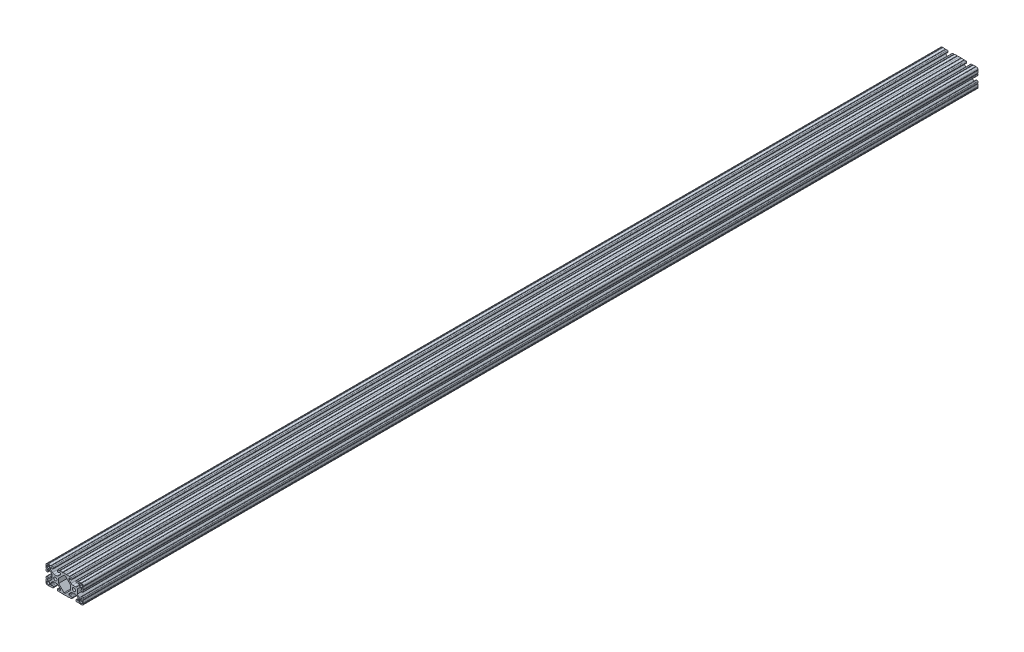
from build123d import *

# Parameters (mm, degrees)
SKETCH3_R      = 3.3274
EXTRUDE1_DEPTH = 914.4


with BuildPart() as part:
    # Sketch3 → Extrude1 (new, symmetric)
    with BuildSketch(Plane.XY):
        with BuildLine():
            Line((15.764194098, 19.048065876), (19.05, 19.16278985))
            Line((19.05, 19.16278985), (22.335805902, 19.048065876))
            Line((22.335805902, 19.048065876), (22.405105476, 19.045645881))
            ThreePointArc((22.405105476, 19.045645881), (22.993059391, 18.4151425), (23.623562772, 19.003096415))
            Line((23.623562772, 19.003096415), (28.755105476, 18.823898995))
            ThreePointArc((28.755105476, 18.823898995), (29.343059391, 18.193395614), (29.973562772, 18.781349529))
            Line((29.973562772, 18.781349529), (32.517119053, 18.692526586))
            ThreePointArc((32.517119053, 18.692526586), (33.613895135, 18.192696929), (34.036, 17.063726184))
            Line((34.036, 17.063726184), (34.007633689, 16.25142132))
            ThreePointArc((34.007633689, 16.25142132), (33.507804032, 15.154645238), (32.378833287, 14.732540373))
            Line((32.378833287, 14.732540373), (31.2293, 14.732540373))
            Line((31.2293, 14.732540373), (31.2293, 15.644526586))
            Line((31.2293, 15.644526586), (29.083, 15.644526586))
            ThreePointArc((29.083, 15.644526586), (28.184974388, 15.272552198), (27.813, 14.374526586))
            Line((27.813, 14.374526586), (27.813, 12.968312693))
            ThreePointArc((27.813, 12.968312693), (27.909672994, 12.482304734), (28.184974388, 12.070287081))
            Line((28.184974388, 12.070287081), (32.107677258, 8.147584211))
            ThreePointArc((32.107677258, 8.147584211), (33.648623281, 7.117956996), (35.466293048, 6.7564))
            Line((35.466293048, 6.7564), (40.733706952, 6.7564))
            ThreePointArc((40.733706952, 6.7564), (42.551376719, 7.117956996), (44.092322742, 8.147584211))
            Line((44.092322742, 8.147584211), (48.015025612, 12.070287081))
            ThreePointArc((48.015025612, 12.070287081), (48.290327006, 12.482304734), (48.387, 12.968312693))
            Line((48.387, 12.968312693), (48.387, 14.374526586))
            ThreePointArc((48.387, 14.374526586), (48.015025612, 15.272552198), (47.117, 15.644526586))
            Line((47.117, 15.644526586), (44.9707, 15.644526586))
            Line((44.9707, 15.644526586), (44.9707, 14.732540373))
            Line((44.9707, 14.732540373), (43.821166713, 14.732540373))
            ThreePointArc((43.821166713, 14.732540373), (42.692195968, 15.154645238), (42.192366311, 16.25142132))
            Line((42.192366311, 16.25142132), (42.164, 17.063726184))
            ThreePointArc((42.164, 17.063726184), (42.586104865, 18.192696929), (43.682880947, 18.692526586))
            Line((43.682880947, 18.692526586), (46.226437228, 18.781349529))
            ThreePointArc((46.226437228, 18.781349529), (46.856940609, 18.193395614), (47.444894524, 18.823898995))
            Line((47.444894524, 18.823898995), (52.576437228, 19.003096415))
            ThreePointArc((52.576437228, 19.003096415), (53.206940609, 18.4151425), (53.794894524, 19.045645881))
            Line((53.794894524, 19.045645881), (53.864194098, 19.048065876))
            ThreePointArc((53.864194098, 19.048065876), (56.22006403, 18.12006403), (57.148065876, 15.764194098))
            Line((57.148065876, 15.764194098), (57.145645881, 15.694894524))
            ThreePointArc((57.145645881, 15.694894524), (56.5151425, 15.106940609), (57.103096415, 14.476437228))
            Line((57.103096415, 14.476437228), (56.923898995, 9.344894524))
            ThreePointArc((56.923898995, 9.344894524), (56.293395614, 8.756940609), (56.881349529, 8.126437228))
            Line((56.881349529, 8.126437228), (56.792526586, 5.582880947))
            ThreePointArc((56.792526586, 5.582880947), (56.292696929, 4.486104865), (55.163726184, 4.064))
            Line((55.163726184, 4.064), (54.35142132, 4.092366311))
            ThreePointArc((54.35142132, 4.092366311), (53.254645238, 4.592195968), (52.832540373, 5.721166713))
            Line((52.832540373, 5.721166713), (52.832540373, 6.8707))
            Line((52.832540373, 6.8707), (53.744526586, 6.8707))
            Line((53.744526586, 6.8707), (53.744526586, 9.017))
            ThreePointArc((53.744526586, 9.017), (53.372552198, 9.915025612), (52.474526586, 10.287))
            Line((52.474526586, 10.287), (50.542261469, 10.287))
            Line((50.542261469, 10.287), (44.8564, 4.601138531))
            Line((44.8564, 4.601138531), (44.8564, -4.601138531))
            Line((44.8564, -4.601138531), (50.542261469, -10.287))
            Line((50.542261469, -10.287), (52.474526586, -10.287))
            ThreePointArc((52.474526586, -10.287), (53.372552198, -9.915025612), (53.744526586, -9.017))
            Line((53.744526586, -9.017), (53.744526586, -6.8707))
            Line((53.744526586, -6.8707), (52.832540373, -6.8707))
            Line((52.832540373, -6.8707), (52.832540373, -5.721166713))
            ThreePointArc((52.832540373, -5.721166713), (53.254645238, -4.592195968), (54.35142132, -4.092366311))
            Line((54.35142132, -4.092366311), (55.163726184, -4.064))
            ThreePointArc((55.163726184, -4.064), (56.292696929, -4.486104865), (56.792526586, -5.582880947))
            Line((56.792526586, -5.582880947), (56.881349529, -8.126437228))
            ThreePointArc((56.881349529, -8.126437228), (56.293395614, -8.756940609), (56.923898995, -9.344894524))
            Line((56.923898995, -9.344894524), (57.103096415, -14.476437228))
            ThreePointArc((57.103096415, -14.476437228), (56.5151425, -15.106940609), (57.145645881, -15.694894524))
            Line((57.145645881, -15.694894524), (57.148065876, -15.764194098))
            ThreePointArc((57.148065876, -15.764194098), (56.22006403, -18.12006403), (53.864194098, -19.048065876))
            Line((53.864194098, -19.048065876), (53.794894524, -19.045645881))
            ThreePointArc((53.794894524, -19.045645881), (53.206940609, -18.4151425), (52.576437228, -19.003096415))
            Line((52.576437228, -19.003096415), (47.444894524, -18.823898995))
            ThreePointArc((47.444894524, -18.823898995), (46.856940609, -18.193395614), (46.226437228, -18.781349529))
            Line((46.226437228, -18.781349529), (43.682880947, -18.692526586))
            ThreePointArc((43.682880947, -18.692526586), (42.586104865, -18.192696929), (42.164, -17.063726184))
            Line((42.164, -17.063726184), (42.192366311, -16.25142132))
            ThreePointArc((42.192366311, -16.25142132), (42.692195968, -15.154645238), (43.821166713, -14.732540373))
            Line((43.821166713, -14.732540373), (44.9707, -14.732540373))
            Line((44.9707, -14.732540373), (44.9707, -15.644526586))
            Line((44.9707, -15.644526586), (47.117, -15.644526586))
            ThreePointArc((47.117, -15.644526586), (48.015025612, -15.272552198), (48.387, -14.374526586))
            Line((48.387, -14.374526586), (48.387, -12.968312693))
            ThreePointArc((48.387, -12.968312693), (48.290327006, -12.482304734), (48.015025612, -12.070287081))
            Line((48.015025612, -12.070287081), (44.092322742, -8.147584211))
            ThreePointArc((44.092322742, -8.147584211), (42.551376719, -7.117956996), (40.733706952, -6.7564))
            Line((40.733706952, -6.7564), (35.466293048, -6.7564))
            ThreePointArc((35.466293048, -6.7564), (33.648623281, -7.117956996), (32.107677258, -8.147584211))
            Line((32.107677258, -8.147584211), (28.184974388, -12.070287081))
            ThreePointArc((28.184974388, -12.070287081), (27.909672994, -12.482304734), (27.813, -12.968312693))
            Line((27.813, -12.968312693), (27.813, -14.374526586))
            ThreePointArc((27.813, -14.374526586), (28.184974388, -15.272552198), (29.083, -15.644526586))
            Line((29.083, -15.644526586), (31.2293, -15.644526586))
            Line((31.2293, -15.644526586), (31.2293, -14.732540373))
            Line((31.2293, -14.732540373), (32.378833287, -14.732540373))
            ThreePointArc((32.378833287, -14.732540373), (33.507804032, -15.154645238), (34.007633689, -16.25142132))
            Line((34.007633689, -16.25142132), (34.036, -17.063726184))
            ThreePointArc((34.036, -17.063726184), (33.613895135, -18.192696929), (32.517119053, -18.692526586))
            Line((32.517119053, -18.692526586), (29.973562772, -18.781349529))
            ThreePointArc((29.973562772, -18.781349529), (29.343059391, -18.193395614), (28.755105476, -18.823898995))
            Line((28.755105476, -18.823898995), (23.623562772, -19.003096415))
            ThreePointArc((23.623562772, -19.003096415), (22.993059391, -18.4151425), (22.405105476, -19.045645881))
            Line((22.405105476, -19.045645881), (22.335805902, -19.048065876))
            Line((22.335805902, -19.048065876), (19.05, -19.16278985))
            Line((19.05, -19.16278985), (15.764194098, -19.048065876))
            Line((15.764194098, -19.048065876), (15.694894524, -19.045645881))
            ThreePointArc((15.694894524, -19.045645881), (15.106940609, -18.4151425), (14.476437228, -19.003096415))
            Line((14.476437228, -19.003096415), (9.344894524, -18.823898995))
            ThreePointArc((9.344894524, -18.823898995), (8.756940609, -18.193395614), (8.126437228, -18.781349529))
            Line((8.126437228, -18.781349529), (5.582880947, -18.692526586))
            ThreePointArc((5.582880947, -18.692526586), (4.486104865, -18.192696929), (4.064, -17.063726184))
            Line((4.064, -17.063726184), (4.092366311, -16.25142132))
            ThreePointArc((4.092366311, -16.25142132), (4.592195968, -15.154645238), (5.721166713, -14.732540373))
            Line((5.721166713, -14.732540373), (6.8707, -14.732540373))
            Line((6.8707, -14.732540373), (6.8707, -15.644526586))
            Line((6.8707, -15.644526586), (9.017, -15.644526586))
            ThreePointArc((9.017, -15.644526586), (9.915025612, -15.272552198), (10.287, -14.374526586))
            Line((10.287, -14.374526586), (10.287, -12.968312693))
            ThreePointArc((10.287, -12.968312693), (10.190327006, -12.482304734), (9.915025612, -12.070287081))
            Line((9.915025612, -12.070287081), (5.992322742, -8.147584211))
            ThreePointArc((5.992322742, -8.147584211), (4.451376719, -7.117956996), (2.633706952, -6.7564))
            Line((2.633706952, -6.7564), (-2.633706952, -6.7564))
            ThreePointArc((-2.633706952, -6.7564), (-4.451376719, -7.117956996), (-5.992322742, -8.147584211))
            Line((-5.992322742, -8.147584211), (-9.915025612, -12.070287081))
            ThreePointArc((-9.915025612, -12.070287081), (-10.190327006, -12.482304734), (-10.287, -12.968312693))
            Line((-10.287, -12.968312693), (-10.287, -14.374526586))
            ThreePointArc((-10.287, -14.374526586), (-9.915025612, -15.272552198), (-9.017, -15.644526586))
            Line((-9.017, -15.644526586), (-6.8707, -15.644526586))
            Line((-6.8707, -15.644526586), (-6.8707, -14.732540373))
            Line((-6.8707, -14.732540373), (-5.721166713, -14.732540373))
            ThreePointArc((-5.721166713, -14.732540373), (-4.592195968, -15.154645238), (-4.092366311, -16.25142132))
            Line((-4.092366311, -16.25142132), (-4.064, -17.063726184))
            ThreePointArc((-4.064, -17.063726184), (-4.486104865, -18.192696929), (-5.582880947, -18.692526586))
            Line((-5.582880947, -18.692526586), (-8.126437228, -18.781349529))
            ThreePointArc((-8.126437228, -18.781349529), (-8.756940609, -18.193395614), (-9.344894524, -18.823898995))
            Line((-9.344894524, -18.823898995), (-14.476437228, -19.003096415))
            ThreePointArc((-14.476437228, -19.003096415), (-15.106940609, -18.4151425), (-15.694894524, -19.045645881))
            Line((-15.694894524, -19.045645881), (-15.764194098, -19.048065876))
            ThreePointArc((-15.764194098, -19.048065876), (-18.12006403, -18.12006403), (-19.048065876, -15.764194098))
            Line((-19.048065876, -15.764194098), (-19.045645881, -15.694894524))
            ThreePointArc((-19.045645881, -15.694894524), (-18.4151425, -15.106940609), (-19.003096415, -14.476437228))
            Line((-19.003096415, -14.476437228), (-18.823898995, -9.344894524))
            ThreePointArc((-18.823898995, -9.344894524), (-18.193395614, -8.756940609), (-18.781349529, -8.126437228))
            Line((-18.781349529, -8.126437228), (-18.692526586, -5.582880947))
            ThreePointArc((-18.692526586, -5.582880947), (-18.192696929, -4.486104865), (-17.063726184, -4.064))
            Line((-17.063726184, -4.064), (-16.25142132, -4.092366311))
            ThreePointArc((-16.25142132, -4.092366311), (-15.154645238, -4.592195968), (-14.732540373, -5.721166713))
            Line((-14.732540373, -5.721166713), (-14.732540373, -6.8707))
            Line((-14.732540373, -6.8707), (-15.644526586, -6.8707))
            Line((-15.644526586, -6.8707), (-15.644526586, -9.017))
            ThreePointArc((-15.644526586, -9.017), (-15.272552198, -9.915025612), (-14.374526586, -10.287))
            Line((-14.374526586, -10.287), (-12.442261469, -10.287))
            Line((-12.442261469, -10.287), (-6.7564, -4.601138531))
            Line((-6.7564, -4.601138531), (-6.7564, 4.601138531))
            Line((-6.7564, 4.601138531), (-12.442261469, 10.287))
            Line((-12.442261469, 10.287), (-14.374526586, 10.287))
            ThreePointArc((-14.374526586, 10.287), (-15.272552198, 9.915025612), (-15.644526586, 9.017))
            Line((-15.644526586, 9.017), (-15.644526586, 6.8707))
            Line((-15.644526586, 6.8707), (-14.732540373, 6.8707))
            Line((-14.732540373, 6.8707), (-14.732540373, 5.721166713))
            ThreePointArc((-14.732540373, 5.721166713), (-15.154645238, 4.592195968), (-16.25142132, 4.092366311))
            Line((-16.25142132, 4.092366311), (-17.063726184, 4.064))
            ThreePointArc((-17.063726184, 4.064), (-18.192696929, 4.486104865), (-18.692526586, 5.582880947))
            Line((-18.692526586, 5.582880947), (-18.781349529, 8.126437228))
            ThreePointArc((-18.781349529, 8.126437228), (-18.193395614, 8.756940609), (-18.823898995, 9.344894524))
            Line((-18.823898995, 9.344894524), (-19.003096415, 14.476437228))
            ThreePointArc((-19.003096415, 14.476437228), (-18.4151425, 15.106940609), (-19.045645881, 15.694894524))
            Line((-19.045645881, 15.694894524), (-19.048065876, 15.764194098))
            ThreePointArc((-19.048065876, 15.764194098), (-18.12006403, 18.12006403), (-15.764194098, 19.048065876))
            Line((-15.764194098, 19.048065876), (-15.694894524, 19.045645881))
            ThreePointArc((-15.694894524, 19.045645881), (-15.106940609, 18.4151425), (-14.476437228, 19.003096415))
            Line((-14.476437228, 19.003096415), (-9.344894524, 18.823898995))
            ThreePointArc((-9.344894524, 18.823898995), (-8.756940609, 18.193395614), (-8.126437228, 18.781349529))
            Line((-8.126437228, 18.781349529), (-5.582880947, 18.692526586))
            ThreePointArc((-5.582880947, 18.692526586), (-4.486104865, 18.192696929), (-4.064, 17.063726184))
            Line((-4.064, 17.063726184), (-4.092366311, 16.25142132))
            ThreePointArc((-4.092366311, 16.25142132), (-4.592195968, 15.154645238), (-5.721166713, 14.732540373))
            Line((-5.721166713, 14.732540373), (-6.8707, 14.732540373))
            Line((-6.8707, 14.732540373), (-6.8707, 15.644526586))
            Line((-6.8707, 15.644526586), (-9.017, 15.644526586))
            ThreePointArc((-9.017, 15.644526586), (-9.915025612, 15.272552198), (-10.287, 14.374526586))
            Line((-10.287, 14.374526586), (-10.287, 12.968312693))
            ThreePointArc((-10.287, 12.968312693), (-10.190327006, 12.482304734), (-9.915025612, 12.070287081))
            Line((-9.915025612, 12.070287081), (-5.992322742, 8.147584211))
            ThreePointArc((-5.992322742, 8.147584211), (-4.451376719, 7.117956996), (-2.633706952, 6.7564))
            Line((-2.633706952, 6.7564), (2.633706952, 6.7564))
            ThreePointArc((2.633706952, 6.7564), (4.451376719, 7.117956996), (5.992322742, 8.147584211))
            Line((5.992322742, 8.147584211), (9.915025612, 12.070287081))
            ThreePointArc((9.915025612, 12.070287081), (10.190327006, 12.482304734), (10.287, 12.968312693))
            Line((10.287, 12.968312693), (10.287, 14.374526586))
            ThreePointArc((10.287, 14.374526586), (9.915025612, 15.272552198), (9.017, 15.644526586))
            Line((9.017, 15.644526586), (6.8707, 15.644526586))
            Line((6.8707, 15.644526586), (6.8707, 14.732540373))
            Line((6.8707, 14.732540373), (5.721166713, 14.732540373))
            ThreePointArc((5.721166713, 14.732540373), (4.592195968, 15.154645238), (4.092366311, 16.25142132))
            Line((4.092366311, 16.25142132), (4.064, 17.063726184))
            ThreePointArc((4.064, 17.063726184), (4.486104865, 18.192696929), (5.582880947, 18.692526586))
            Line((5.582880947, 18.692526586), (8.126437228, 18.781349529))
            ThreePointArc((8.126437228, 18.781349529), (8.756940609, 18.193395614), (9.344894524, 18.823898995))
            Line((9.344894524, 18.823898995), (14.476437228, 19.003096415))
            ThreePointArc((14.476437228, 19.003096415), (15.106940609, 18.4151425), (15.694894524, 19.045645881))
            Line((15.694894524, 19.045645881), (15.764194098, 19.048065876))
        make_face()
        Circle(SKETCH3_R, mode=Mode.SUBTRACT)
        with Locations(Location((38.1, 0, 0), (0, 0, 180))):
            Circle(SKETCH3_R, mode=Mode.SUBTRACT)
        Polygon((17.799788055, 15.644526586), (20.300211945, 15.644526586), (31.3436, 4.601138531), (31.3436, -4.601138531), (20.300211945, -15.644526586), (17.799788055, -15.644526586), (6.7564, -4.601138531), (6.7564, 4.601138531), align=None, mode=Mode.SUBTRACT)
        with BuildLine():
            Line((-11.8364, 11.8364), (-11.8364, 17.2212))
            Line((-11.8364, 17.2212), (-14.4272, 17.2212))
            ThreePointArc((-14.4272, 17.2212), (-16.402856347, 16.402856347), (-17.2212, 14.4272))
            Line((-17.2212, 14.4272), (-17.2212, 11.8364))
            Line((-17.2212, 11.8364), (-11.8364, 11.8364))
        make_face(mode=Mode.SUBTRACT)
        with BuildLine():
            Line((49.9364, -11.8364), (49.9364, -17.2212))
            Line((49.9364, -17.2212), (52.5272, -17.2212))
            ThreePointArc((52.5272, -17.2212), (54.502856347, -16.402856347), (55.3212, -14.4272))
            Line((55.3212, -14.4272), (55.3212, -11.8364))
            Line((55.3212, -11.8364), (49.9364, -11.8364))
        make_face(mode=Mode.SUBTRACT)
        with BuildLine():
            Line((-11.8364, -17.2212), (-14.4272, -17.2212))
            ThreePointArc((-14.4272, -17.2212), (-16.402856347, -16.402856347), (-17.2212, -14.4272))
            Line((-17.2212, -14.4272), (-17.2212, -11.8364))
            Line((-17.2212, -11.8364), (-11.8364, -11.8364))
            Line((-11.8364, -11.8364), (-11.8364, -17.2212))
        make_face(mode=Mode.SUBTRACT)
        with BuildLine():
            Line((49.9364, 17.2212), (52.5272, 17.2212))
            ThreePointArc((52.5272, 17.2212), (54.502856347, 16.402856347), (55.3212, 14.4272))
            Line((55.3212, 14.4272), (55.3212, 11.8364))
            Line((55.3212, 11.8364), (49.9364, 11.8364))
            Line((49.9364, 11.8364), (49.9364, 17.2212))
        make_face(mode=Mode.SUBTRACT)
    extrude(amount=EXTRUDE1_DEPTH, both=True)


solid = part.part
